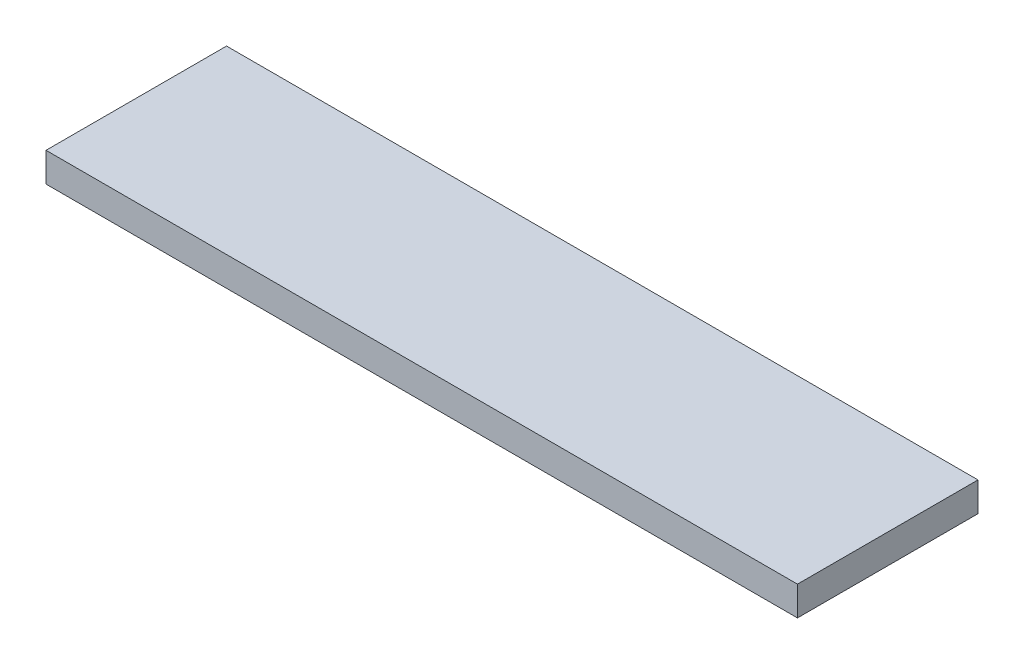
from build123d import *

# Parameters (mm, degrees)
SKETCH1_W           = 977.9
SKETCH1_H           = 234.95
BOSS_EXTRUDE1_DEPTH = 38.1


with BuildPart() as part:
    # Sketch1 → Boss-Extrude1 (new body)
    with BuildSketch(Plane(origin=(0, 0, 0), x_dir=(1, 0, 0), z_dir=(0, 1, 0))):
        with Locations((65.259379861, 286.740053763)):
            Rectangle(SKETCH1_W, SKETCH1_H)
    extrude(amount=BOSS_EXTRUDE1_DEPTH)


solid = part.part
